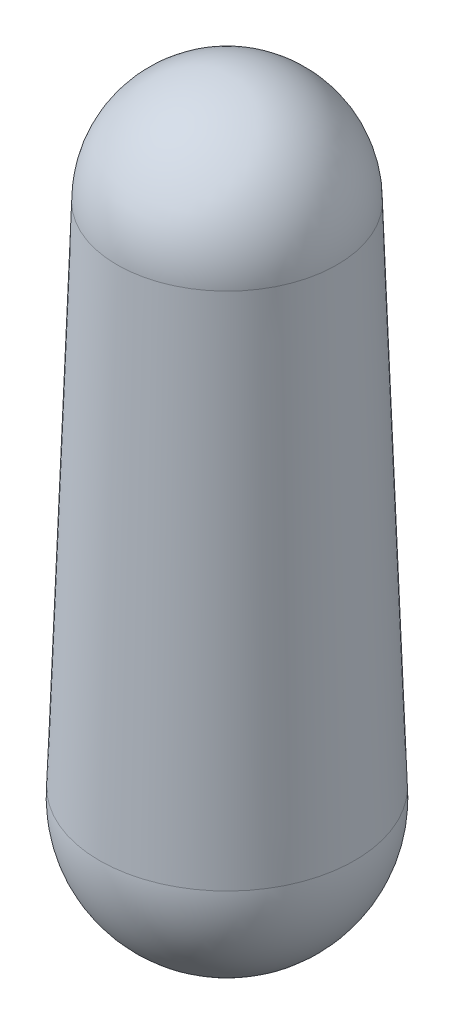
from build123d import *

# Parameters (mm, degrees)
SKETCH2_R           = 2.48
BOSS_EXTRUDE1_DEPTH = 10
BOSS_EXTRUDE1_TAPER = 2


with BuildPart() as part:
    # Sketch1 → Revolve1 (revolve)
    with BuildSketch(Plane(origin=(0, 0, 0), x_dir=(1, 0, 0), z_dir=(0, 1, 0))):
        with BuildLine():
            Line((0, 2.48), (0, -2.48))
            ThreePointArc((0, -2.48), (2.48, 0), (0, 2.48))
        make_face()
    revolve(axis=Axis((0, 0, -2.48), (0, 0, 1)))

    # Sketch2 → Boss-Extrude1 (add)
    with BuildSketch(Plane(origin=(0, 0, 0), x_dir=(1, 0, 0), z_dir=(0, 1, 0))):
        Circle(SKETCH2_R)
    extrude(amount=BOSS_EXTRUDE1_DEPTH, taper=BOSS_EXTRUDE1_TAPER)

    # Sketch3 → Revolve2 (revolve)
    with BuildSketch(Plane(origin=(0, 10, 0), x_dir=(1, 0, 0), z_dir=(0, 1, 0))):
        with BuildLine():
            Line((0, 2.130792305), (0, -2.130792305))
            ThreePointArc((0, -2.130792305), (2.130792305, 0), (0, 2.130792305))
        make_face()
    revolve(axis=Axis((0, 10, -2.130792305), (0, 0, 1)))


solid = part.part
